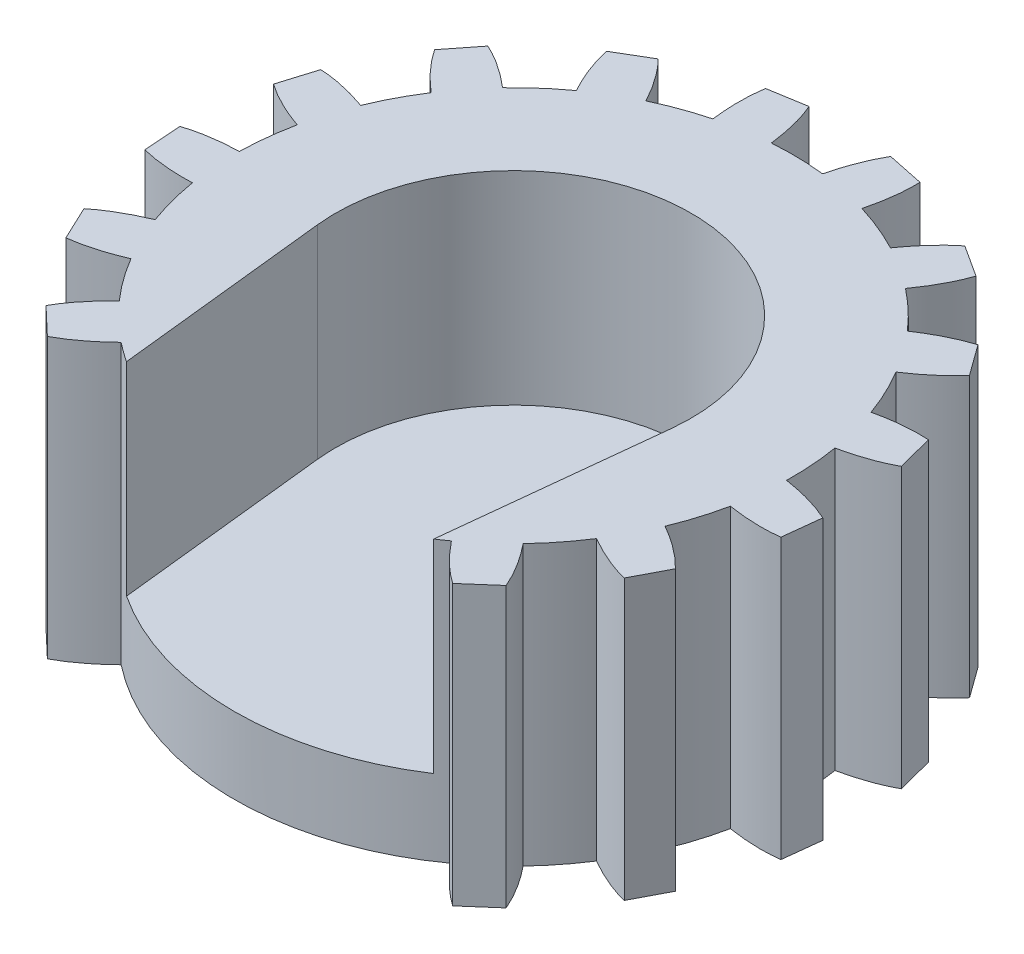
from build123d import *

# Parameters (mm, degrees)
EXTRUDE_1_DEPTH     = 5.5
CUT_EXTRUDE_START   = -4
CUT_EXTRUDE_1_DEPTH = 4


with BuildPart() as part:
    # 草图1 → 凸台-拉伸1 (new body)
    with BuildSketch(Plane(origin=(0, 0, 0), x_dir=(1, 0, 0), z_dir=(0, 1, 0))):
        with BuildLine():
            Line((3.969301918, -5.163851143), (4.530344551, -4.672944184))
            add(Edge.make_bspline(
                [(4.530344551, -4.672944184), (4.354405556, -4.246653984), (3.983966518, -3.79183484)],
                knots=[0.855411936, 0.855411936, 0.855411936, 1.601240801, 1.601240801, 1.601240801], degree=2, weights=[1, 0.931269484, 1]))
            ThreePointArc((3.983966518, -3.79183484), (4.321234304, -3.402489494), (4.620598172, -2.983299046))
            add(Edge.make_bspline(
                [(4.620598172, -2.983299046), (5.127473668, -3.278819011), (5.566662, -3.381270549)],
                knots=[4.712389237, 4.712389237, 4.712389237, 5.458105429, 5.458105429, 5.458105429], degree=2, weights=[1, 0.931290007, 1]))
            Line((5.566662, -3.381270549), (5.912482626, -2.720841467))
            add(Edge.make_bspline(
                [(5.912482626, -2.720841467), (5.594430617, -2.38689419), (5.084706876, -2.096605984)],
                knots=[0.855411936, 0.855411936, 0.855411936, 1.601240801, 1.601240801, 1.601240801], degree=2, weights=[1, 0.931269484, 1]))
            ThreePointArc((5.084706876, -2.096605984), (5.258551959, -1.611717084), (5.386271397, -1.11269093))
            add(Edge.make_bspline(
                [(5.386271397, -1.11269093), (5.965672845, -1.205150542), (6.412213532, -1.142030631)],
                knots=[4.712389237, 4.712389237, 4.712389237, 5.458105429, 5.458105429, 5.458105429], degree=2, weights=[1, 0.931290007, 1]))
            Line((6.412213532, -1.142030631), (6.496107161, -0.401274034))
            add(Edge.make_bspline(
                [(6.496107161, -0.401274034), (6.078896824, -0.204771109), (5.498729396, -0.118218872)],
                knots=[0.855411936, 0.855411936, 0.855411936, 1.601240801, 1.601240801, 1.601240801], degree=2, weights=[1, 0.931269484, 1]))
            ThreePointArc((5.498729396, -0.118218872), (5.485673034, 0.396726649), (5.424498823, 0.908192262))
            add(Edge.make_bspline(
                [(5.424498823, 0.908192262), (5.998174848, 1.031280186), (6.391760096, 1.251446852)],
                knots=[4.712389237, 4.712389237, 4.712389237, 5.458105429, 5.458105429, 5.458105429], degree=2, weights=[1, 0.931290007, 1]))
            Line((6.391760096, 1.251446852), (6.202396427, 1.972487682))
            add(Edge.make_bspline(
                [(6.202396427, 1.972487682), (5.74237433, 2.005007445), (5.170118041, 1.876134354)],
                knots=[0.855411936, 0.855411936, 0.855411936, 1.601240801, 1.601240801, 1.601240801], degree=2, weights=[1, 0.931269484, 1]))
            ThreePointArc((5.170118041, 1.876134354), (4.971923568, 2.351590249), (4.730117625, 2.806419056))
            add(Edge.make_bspline(
                [(4.730117625, 2.806419056), (5.2205901, 3.12843081), (5.50806404, 3.475909503)],
                knots=[1.570796584, 1.570796584, 1.570796584, 2.316512776, 2.316512776, 2.316512776], degree=2, weights=[1, 0.931290007, 1]))
            Line((5.50806404, 3.475909503), (5.071017687, 4.079854006))
            add(Edge.make_bspline(
                [(5.071017687, 4.079854006), (4.630312364, 3.943998633), (4.143253596, 3.617105239)],
                knots=[3.997004589, 3.997004589, 3.997004589, 4.742833455, 4.742833455, 4.742833455], degree=2, weights=[1, 0.931269484, 1]))
            ThreePointArc((4.143253596, 3.617105239), (3.786688274, 3.988858556), (3.396907832, 4.325623406))
            add(Edge.make_bspline(
                [(3.396907832, 4.325623406), (3.737935731, 4.803069518), (3.880473415, 5.230931314)],
                knots=[4.712389237, 4.712389237, 4.712389237, 5.458105429, 5.458105429, 5.458105429], degree=2, weights=[1, 0.931290007, 1]))
            Line((3.880473415, 5.230931314), (3.25476991, 5.636213439))
            add(Edge.make_bspline(
                [(3.25476991, 5.636213439), (2.892901055, 5.350330951), (2.556819794, 4.869566019)],
                knots=[0.855411936, 0.855411936, 0.855411936, 1.601240801, 1.601240801, 1.601240801], degree=2, weights=[1, 0.931269484, 1]))
            ThreePointArc((2.556819794, 4.869566019), (2.090039746, 5.087409412), (1.604926812, 5.260628346))
            add(Edge.make_bspline(
                [(1.604926812, 5.260628346), (1.750452428, 5.829027073), (1.728803353, 6.279486867)],
                knots=[4.712389237, 4.712389237, 4.712389237, 5.458105429, 5.458105429, 5.458105429], degree=2, weights=[1, 0.931290007, 1]))
            Line((1.728803353, 6.279486867), (0.99894742, 6.431371016))
            add(Edge.make_bspline(
                [(0.99894742, 6.431371016), (0.764787429, 6.034071427), (0.625073311, 5.464364924)],
                knots=[0.855411936, 0.855411936, 0.855411936, 1.601240801, 1.601240801, 1.601240801], degree=2, weights=[1, 0.931269484, 1]))
            ThreePointArc((0.625073311, 5.464364924), (0.111119769, 5.498877437), (-0.403808466, 5.485156278))
            add(Edge.make_bspline(
                [(-0.403808466, 5.485156278), (-0.473439174, 6.067742222), (-0.656351182, 6.479962922)],
                knots=[4.712389237, 4.712389237, 4.712389237, 5.458105429, 5.458105429, 5.458105429], degree=2, weights=[1, 0.931290007, 1]))
            Line((-0.656351182, 6.479962922), (-1.391788454, 6.3579363))
            add(Edge.make_bspline(
                [(-1.391788454, 6.3579363), (-1.466614978, 5.902877121), (-1.391092786, 5.321171067)],
                knots=[0.855411936, 0.855411936, 0.855411936, 1.601240801, 1.601240801, 1.601240801], degree=2, weights=[1, 0.931269484, 1]))
            ThreePointArc((-1.391092786, 5.321171067), (-1.882807549, 5.167691593), (-2.358007174, 4.96888346))
            add(Edge.make_bspline(
                [(-2.358007174, 4.96888346), (-2.633390192, 5.486975161), (-2.952861853, 5.805284078)],
                knots=[4.712389237, 4.712389237, 4.712389237, 5.458105429, 5.458105429, 5.458105429], degree=2, weights=[1, 0.931290007, 1]))
            Line((-2.952861853, 5.805284078), (-3.594555585, 5.425827056))
            add(Edge.make_bspline(
                [(-3.594555585, 5.425827056), (-3.499942904, 4.974466551), (-3.219384094, 4.459323573)],
                knots=[0.855411936, 0.855411936, 0.855411936, 1.601240801, 1.601240801, 1.601240801], degree=2, weights=[1, 0.931269484, 1]))
            ThreePointArc((-3.219384094, 4.459323573), (-3.622451274, 4.138580365), (-3.993743946, 3.781535397))
            add(Edge.make_bspline(
                [(-3.993743946, 3.781535397), (-4.437687273, 4.165161701), (-4.850572168, 4.34656945)],
                knots=[4.712389237, 4.712389237, 4.712389237, 5.458105429, 5.458105429, 5.458105429], degree=2, weights=[1, 0.931290007, 1]))
            Line((-4.850572168, 4.34656945), (-5.311858066, 3.760929802))
            add(Edge.make_bspline(
                [(-5.311858066, 3.760929802), (-5.060584148, 3.374226709), (-4.612879741, 2.995219719)],
                knots=[0.855411936, 0.855411936, 0.855411936, 1.601240801, 1.601240801, 1.601240801], degree=2, weights=[1, 0.931269484, 1]))
            ThreePointArc((-4.612879741, 2.995219719), (-4.872862882, 2.550530925), (-5.090103469, 2.083470025))
            add(Edge.make_bspline(
                [(-5.090103469, 2.083470025), (-5.642650098, 2.280820072), (-6.093185834, 2.300826534)],
                knots=[4.712389237, 4.712389237, 4.712389237, 5.458105429, 5.458105429, 5.458105429], degree=2, weights=[1, 0.931290007, 1]))
            Line((-6.093185834, 2.300826534), (-6.311764682, 1.588098139))
            add(Edge.make_bspline(
                [(-6.311764682, 1.588098139), (-5.937765461, 1.318278852), (-5.383380418, 1.126594846)],
                knots=[0.855411936, 0.855411936, 0.855411936, 1.601240801, 1.601240801, 1.601240801], degree=2, weights=[1, 0.931269484, 1]))
            ThreePointArc((-5.383380418, 1.126594846), (-5.465167356, 0.618018151), (-5.499016313, 0.104020481))
            add(Edge.make_bspline(
                [(-5.499016313, 0.104020481), (-6.085541759, 0.088441055), (-6.512880989, -0.055655755)],
                knots=[4.712389237, 4.712389237, 4.712389237, 5.458105429, 5.458105429, 5.458105429], degree=2, weights=[1, 0.931290007, 1]))
            Line((-6.512880989, -0.055655755), (-6.459232502, -0.799214978))
            add(Edge.make_bspline(
                [(-6.459232502, -0.799214978), (-6.013018646, -0.915709869), (-5.426825739, -0.894182904)],
                knots=[0.855411936, 0.855411936, 0.855411936, 1.601240801, 1.601240801, 1.601240801], degree=2, weights=[1, 0.931269484, 1]))
            ThreePointArc((-5.426825739, -0.894182904), (-5.319370696, -1.397961398), (-5.165256532, -1.889477606))
            add(Edge.make_bspline(
                [(-5.165256532, -1.889477606), (-5.706547285, -2.115882417), (-6.052975478, -2.404621426)],
                knots=[4.712389237, 4.712389237, 4.712389237, 5.458105429, 5.458105429, 5.458105429], degree=2, weights=[1, 0.931290007, 1]))
            Line((-6.052975478, -2.404621426), (-5.734345181, -3.078589683))
            add(Edge.make_bspline(
                [(-5.734345181, -3.078589683), (-5.276180344, -3.026026897), (-4.737348173, -2.794196298)],
                knots=[3.997004589, 3.997004589, 3.997004589, 4.742833455, 4.742833455, 4.742833455], degree=2, weights=[1, 0.931269484, 1]))
            ThreePointArc((-4.737348173, -2.794196298), (-4.455163547, -3.225138515), (-4.133900236, -3.627791271))
            add(Edge.make_bspline(
                [(-4.133900236, -3.627791271), (-4.55685198, -4.034444244), (-4.775582088, -4.428829649)],
                knots=[1.570796584, 1.570796584, 1.570796584, 2.316512776, 2.316512776, 2.316512776], degree=2, weights=[1, 0.931290007, 1]))
            Line((-4.775582088, -4.428829649), (-4.235002768, -4.942183793))
            add(Edge.make_bspline(
                [(-4.235002768, -4.942183793), (-3.82676465, -4.727662226), (-3.408065486, -4.316837999)],
                knots=[0.855411936, 0.855411936, 0.855411936, 1.601240801, 1.601240801, 1.601240801], degree=2, weights=[1, 0.931269484, 1]))
            ThreePointArc((-3.408065486, -4.316837999), (-0.111119769, -5.498877437), (3.23088756, -4.450996095))
            add(Edge.make_bspline(
                [(3.23088756, -4.450996095), (3.59678076, -4.909664804), (3.969301918, -5.163851143)],
                knots=[1.570796584, 1.570796584, 1.570796584, 2.316512776, 2.316512776, 2.316512776], degree=2, weights=[1, 0.931290007, 1]))
        make_face()
    extrude(amount=EXTRUDE_1_DEPTH)

    # 草图2 → 切除-拉伸1 (cut)
    with BuildSketch(Plane(origin=(0, 5.5, 0), x_dir=(1, 0, 0), z_dir=(0, 1, 0)).offset(CUT_EXTRUDE_START)):
        with BuildLine():
            Line((3.025284073, -4.593218582), (3.479852727, -0.375))
            ThreePointArc((3.479852727, -0.375), (0, 3.5), (-3.479852727, -0.375))
            Line((-3.479852727, -0.375), (-3.025284073, -4.593218582))
            ThreePointArc((-3.025284073, -4.593218582), (0, -5.500000061), (3.025284073, -4.593218582))
        make_face()
    extrude(amount=CUT_EXTRUDE_1_DEPTH, mode=Mode.SUBTRACT)


solid = part.part
